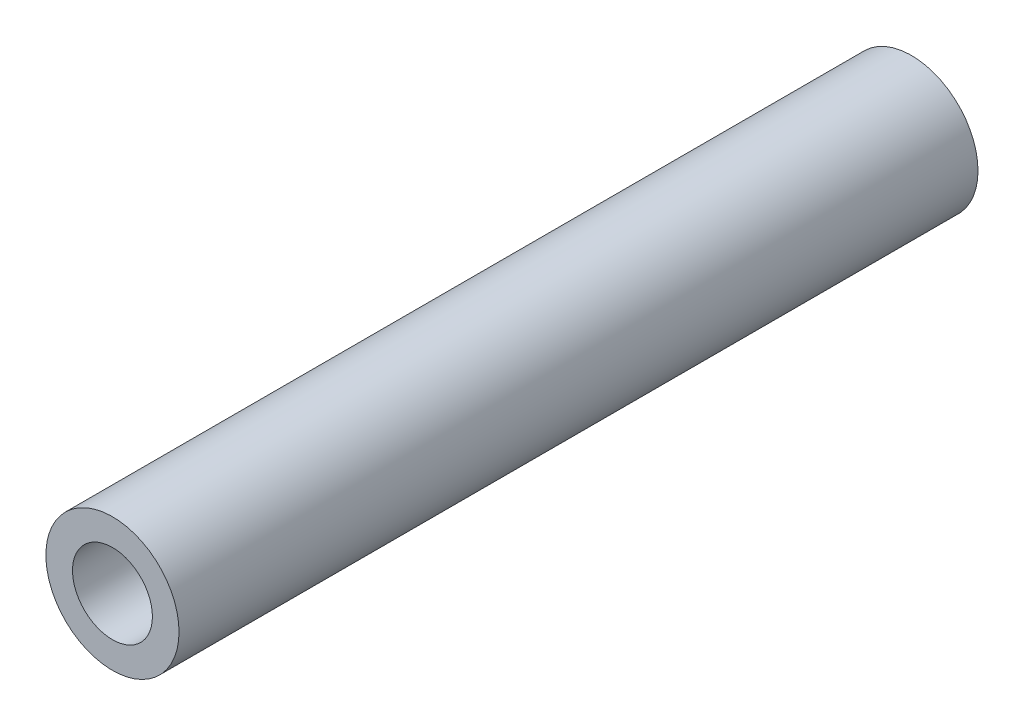
from build123d import *

# Parameters (mm, degrees)
SKETCH_1_R      = 2.5
SKETCH_1_R_2    = 1.5
EXTRUDE_1_DEPTH = 15


with BuildPart() as part:
    # 草图1 → 凸台-拉伸1 (new, symmetric)
    with BuildSketch(Plane.XY):
        Circle(SKETCH_1_R)
        Circle(SKETCH_1_R_2, mode=Mode.SUBTRACT)
    extrude(amount=EXTRUDE_1_DEPTH, both=True)


solid = part.part
